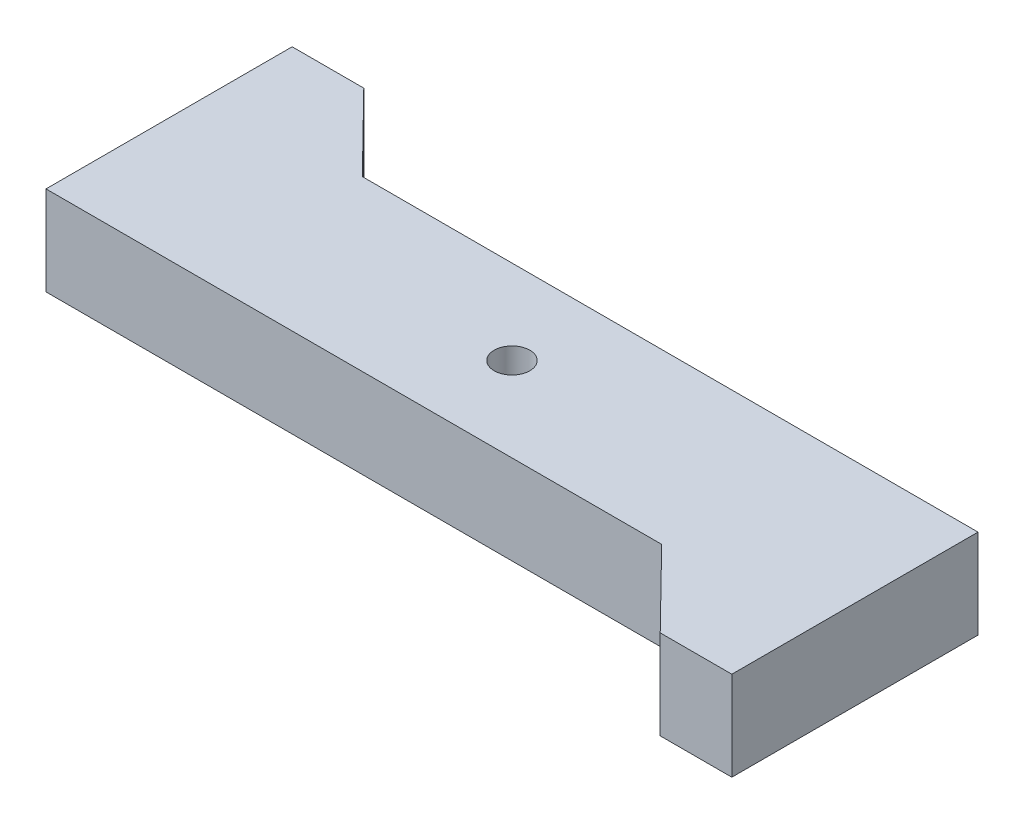
from build123d import *

# Parameters (mm, degrees)
BOSS_EXTRUDE1_DEPTH = 20
SKETCH2_R           = 4
CUT_EXTRUDE1_DEPTH  = 20


with BuildPart() as part:
    # Sketch1 → Boss-Extrude1 (new body)
    with BuildSketch(Plane(origin=(0, 0, 0), x_dir=(1, 0, 0), z_dir=(0, 1, 0))):
        Polygon((-85.536120369, 18.915289152), (-85.536120369, -18.915289152), (52.463879631, -18.915289152), (69.484000539, -36.260475895), (85.536120369, -36.260475895), (85.536120369, -18.915289152), (85.536120369, 18.915289152), (-52.463879631, 18.915289152), (-69.484000539, 36.260475895), (-85.536120369, 36.260475895), align=None)
    extrude(amount=BOSS_EXTRUDE1_DEPTH)

    # Sketch2 → Cut-Extrude1 (cut)
    with BuildSketch(Plane(origin=(0, 20, 0), x_dir=(1, 0, 0), z_dir=(0, 1, 0))):
        with Locations(Location((0, 0, 0), (0, 0, 270))):
            Circle(SKETCH2_R)
    extrude(amount=-CUT_EXTRUDE1_DEPTH, mode=Mode.SUBTRACT)


solid = part.part
